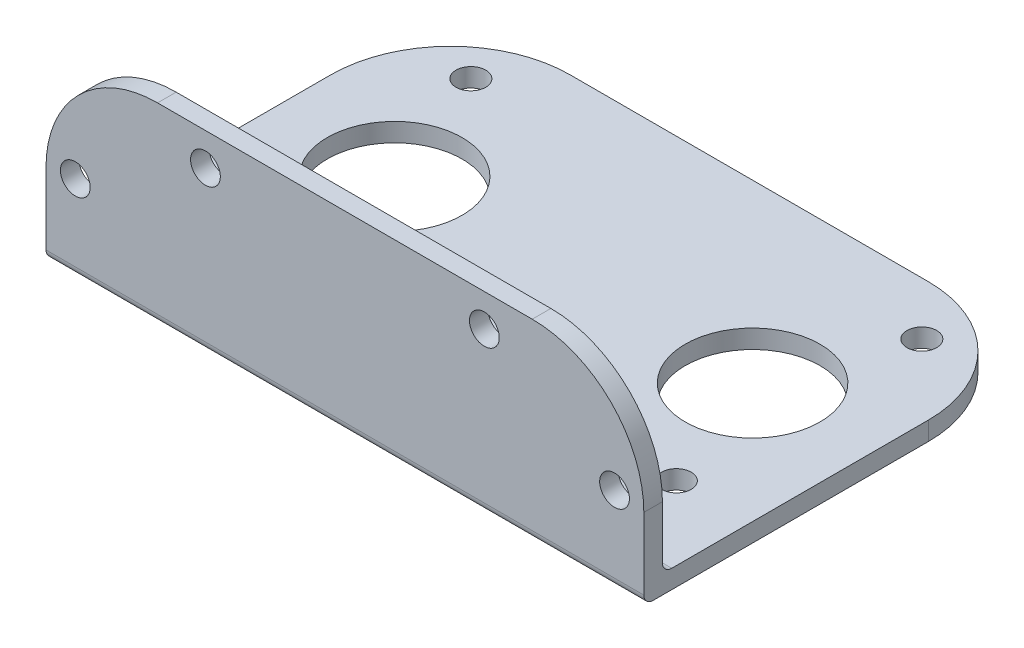
from build123d import *

# Parameters (mm, degrees)
SKETCH_1_R      = 1.6
SKETCH_1_R_2    = 7.25
EXTRUDE_1_DEPTH = 2
SKETCH_2_W      = 32.15
SKETCH_2_H      = 18.7
SKETCH_2_R      = 1.6
EXTRUDE_2_DEPTH = 2
FILLET_1_R      = 12
FILLET_2_R      = 1


with BuildPart() as part:
    # 草图1 → 凸台-拉伸1 (new body)
    with BuildSketch(Plane(origin=(0, 0, 0), x_dir=(1, 0, 0), z_dir=(0, 1, 0))):
        with BuildLine():
            Line((0, 0), (64.3, 0))
            Line((64.3, 0), (64.3, 30.6))
            ThreePointArc((64.3, 30.6), (60.521677477, 39.721677477), (51.4, 43.5))
            Line((51.4, 43.5), (12.9, 43.5))
            ThreePointArc((12.9, 43.5), (3.778322523, 39.721677477), (0, 30.6))
            Line((0, 30.6), (0, 0))
        make_face()
        with Locations(Location((7.89764523, 11.4, 0), (0, 0, 270))):
            Circle(SKETCH_1_R, mode=Mode.SUBTRACT)
        with Locations(Location((7.89764523, 37.8, 0), (0, 0, 270))):
            Circle(SKETCH_1_R, mode=Mode.SUBTRACT)
        with Locations(Location((12.9, 24.6, 0), (0, 0, 270))):
            Circle(SKETCH_1_R_2, mode=Mode.SUBTRACT)
        with Locations(Location((56.40235477, 11.4, 0), (0, 0, 90))):
            Circle(SKETCH_1_R, mode=Mode.SUBTRACT)
        with Locations(Location((56.40235477, 37.8, 0), (0, 0, 90))):
            Circle(SKETCH_1_R, mode=Mode.SUBTRACT)
        with Locations(Location((51.4, 24.6, 0), (0, 0, 90))):
            Circle(SKETCH_1_R_2, mode=Mode.SUBTRACT)
    extrude(amount=EXTRUDE_1_DEPTH)

    # 草图2 → 凸台-拉伸2 (add)
    # profile 1 of 2: a face of its own
    with BuildSketch(Plane.XY):
        with Locations((16.075, 11.35)):
            Rectangle(SKETCH_2_W, SKETCH_2_H)
        with Locations((3.15, 9.2)):
            Circle(SKETCH_2_R, mode=Mode.SUBTRACT)
        with Locations((17.15, 17.2)):
            Circle(SKETCH_2_R, mode=Mode.SUBTRACT)
    # profile 2 of 2: a face of its own
    with BuildSketch(Plane.XY):
        with Locations((48.225, 11.35)):
            Rectangle(SKETCH_2_W, SKETCH_2_H)
        with Locations((61.15, 9.2)):
            Circle(SKETCH_2_R, mode=Mode.SUBTRACT)
        with Locations((47.15, 17.2)):
            Circle(SKETCH_2_R, mode=Mode.SUBTRACT)
    extrude(amount=-EXTRUDE_2_DEPTH)

    # 圆角1
    fillet_1_edges = [part.edges().sort_by_distance(p)[0] for p in [
        (0, 20.7, -1),
        (64.3, 20.7, -1),
    ]]
    fillet(fillet_1_edges, radius=FILLET_1_R)

    # 圆角2
    fillet_2_edges = [part.edges().sort_by_distance(p)[0] for p in [
        (32.15, 2, -2),
        (32.15, 0, 0),
    ]]
    fillet(fillet_2_edges, radius=FILLET_2_R)


solid = part.part
